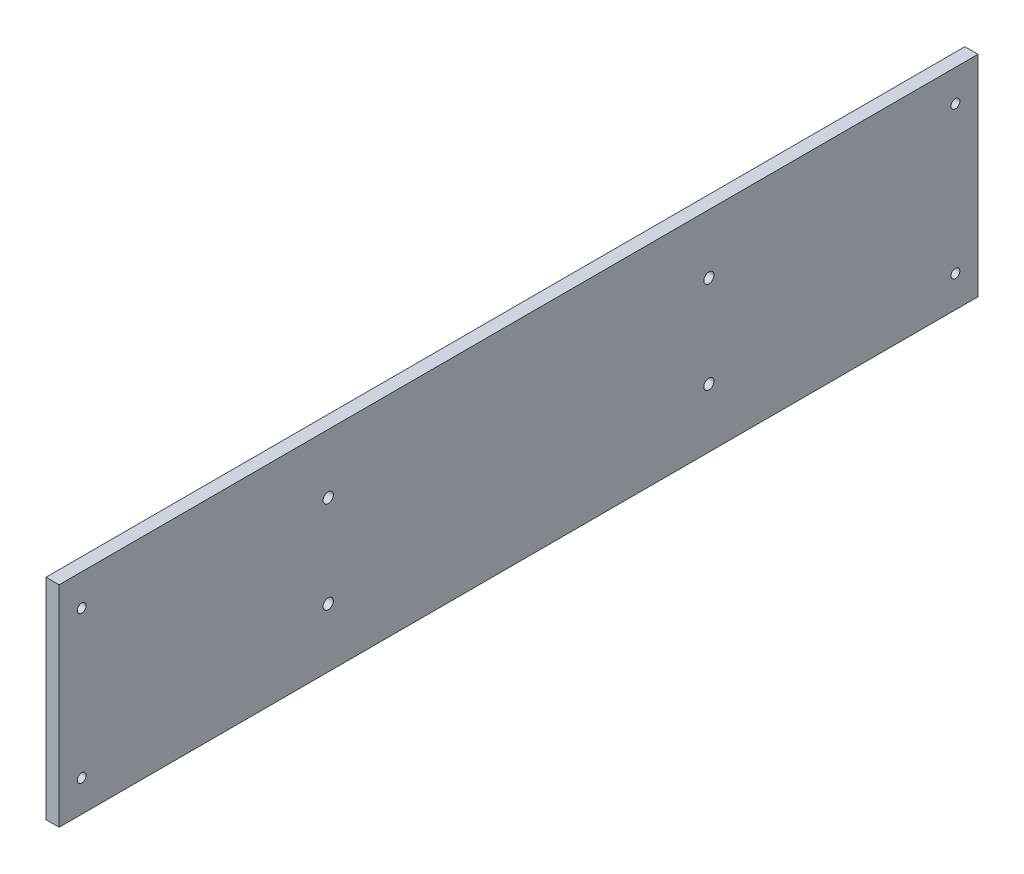
from build123d import *

# Parameters (mm, degrees)
SKETCH1_W              = 444.5
SKETCH1_H              = 101.6
BOSS_EXTRUDE1_DEPTH    = 6.35
F_10_CLEARANCE_HOLE1_D = 4.9784
F_8_CLEARANCE_HOLE1_D  = 4.3053


with BuildPart() as part:
    # Sketch1 → Boss-Extrude1 (new body)
    with BuildSketch(Plane(origin=(0, 0, 0), x_dir=(0, 0, -1), z_dir=(1, 0, 0))):
        Rectangle(SKETCH1_W, SKETCH1_H)
    extrude(amount=BOSS_EXTRUDE1_DEPTH)

    # #10 Clearance Hole1 (through all)
    with Locations(Plane(origin=(6.35, 0, 0), x_dir=(0, 0, -1), z_dir=(1, 0, 0))):
        with Locations((92.075, 22.225), (92.075, -22.225), (-92.075, 22.225), (-92.075, -22.225)):
            Hole(F_10_CLEARANCE_HOLE1_D / 2)

    # #8 Clearance Hole1 (through all)
    with Locations(Plane(origin=(6.35, 0, 0), x_dir=(0, 0, -1), z_dir=(1, 0, 0))):
        with Locations((-211.328, 35.56), (-211.328, -35.56), (211.328, -35.56), (211.328, 35.56)):
            Hole(F_8_CLEARANCE_HOLE1_D / 2)


solid = part.part
